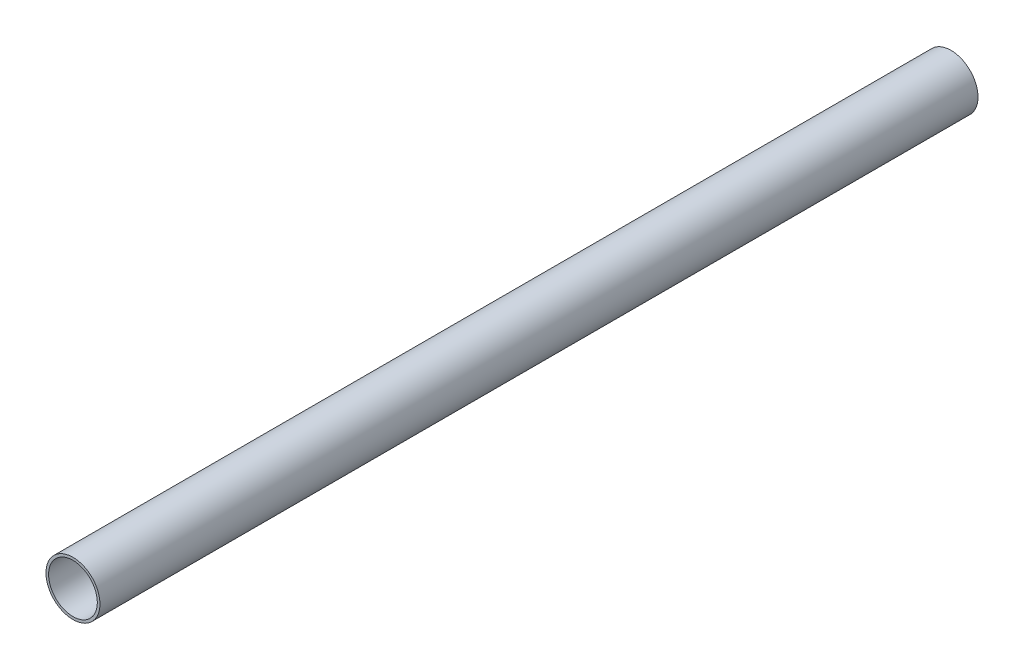
from build123d import *

# Parameters (mm, degrees)
SKETCH1_R           = 0.415
SKETCH1_R_2         = 0.375
BOSS_EXTRUDE1_DEPTH = 13.5


with BuildPart() as part:
    # Sketch1 → Boss-Extrude1 (new body)
    with BuildSketch(Plane.XY):
        Circle(SKETCH1_R)
        Circle(SKETCH1_R_2, mode=Mode.SUBTRACT)
    extrude(amount=BOSS_EXTRUDE1_DEPTH)


solid = part.part
